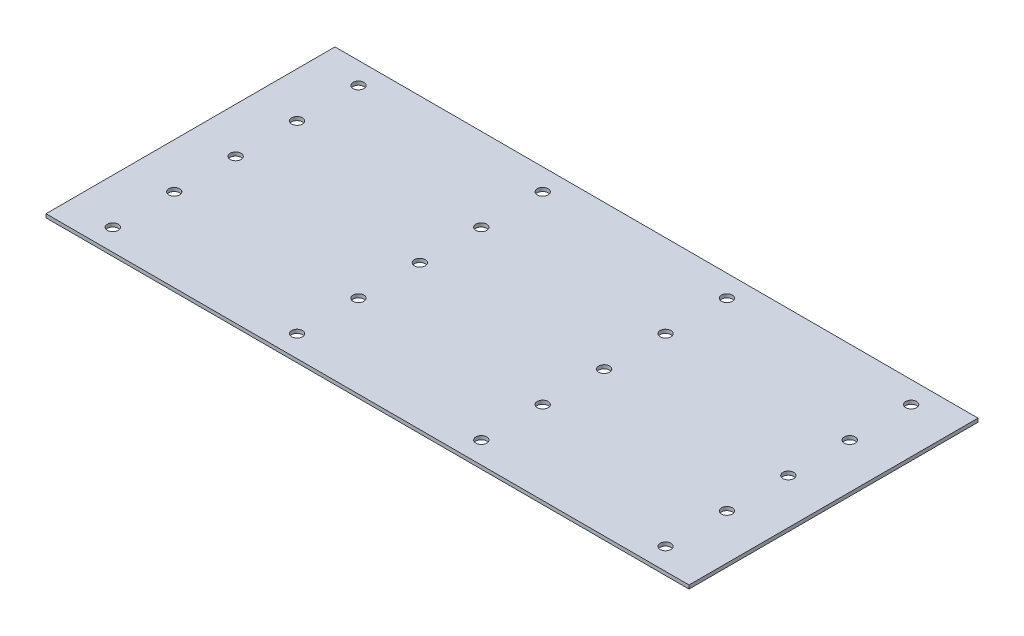
from build123d import *

# Parameters (mm, degrees)
SKETCH1_W           = 178
SKETCH1_H           = 80
BOSS_EXTRUDE1_DEPTH = 1
SKETCH2_R           = 1.5
CUT_EXTRUDE1_DEPTH  = 1


with BuildPart() as part:
    # Sketch1 → Boss-Extrude1 (new body)
    with BuildSketch(Plane(origin=(0, 0, 0), x_dir=(1, 0, 0), z_dir=(0, 1, 0))):
        Rectangle(SKETCH1_W, SKETCH1_H)
    extrude(amount=BOSS_EXTRUDE1_DEPTH)

    # Sketch2 → Cut-Extrude1 (cut)
    with BuildSketch(Plane(origin=(0, 1, 0), x_dir=(1, 0, 0), z_dir=(0, 1, 0))):
        with Locations(Location((-76.5, 34, 0), (0, 0, 270))):
            Circle(SKETCH2_R)
        with Locations(Location((-76.5, 17, 0), (0, 0, 270))):
            Circle(SKETCH2_R)
        with Locations(Location((-76.5, 0, 0), (0, 0, 270))):
            Circle(SKETCH2_R)
        with Locations(Location((-76.5, -17, 0), (0, 0, 270))):
            Circle(SKETCH2_R)
        with Locations(Location((-76.5, -34, 0), (0, 0, 270))):
            Circle(SKETCH2_R)
        with Locations(Location((-25.5, 34, 0), (0, 0, 270))):
            Circle(SKETCH2_R)
        with Locations(Location((-25.5, 17, 0), (0, 0, 270))):
            Circle(SKETCH2_R)
        with Locations(Location((-25.5, 0, 0), (0, 0, 270))):
            Circle(SKETCH2_R)
        with Locations(Location((-25.5, -17, 0), (0, 0, 270))):
            Circle(SKETCH2_R)
        with Locations(Location((-25.5, -34, 0), (0, 0, 270))):
            Circle(SKETCH2_R)
        with Locations(Location((25.5, 34, 0), (0, 0, 270))):
            Circle(SKETCH2_R)
        with Locations(Location((25.5, 17, 0), (0, 0, 270))):
            Circle(SKETCH2_R)
        with Locations(Location((25.5, 0, 0), (0, 0, 270))):
            Circle(SKETCH2_R)
        with Locations(Location((25.5, -17, 0), (0, 0, 270))):
            Circle(SKETCH2_R)
        with Locations(Location((25.5, -34, 0), (0, 0, 270))):
            Circle(SKETCH2_R)
        with Locations(Location((76.5, 34, 0), (0, 0, 270))):
            Circle(SKETCH2_R)
        with Locations(Location((76.5, 17, 0), (0, 0, 270))):
            Circle(SKETCH2_R)
        with Locations(Location((76.5, 0, 0), (0, 0, 270))):
            Circle(SKETCH2_R)
        with Locations(Location((76.5, -17, 0), (0, 0, 270))):
            Circle(SKETCH2_R)
        with Locations(Location((76.5, -34, 0), (0, 0, 270))):
            Circle(SKETCH2_R)
    extrude(amount=-CUT_EXTRUDE1_DEPTH, mode=Mode.SUBTRACT)


solid = part.part
